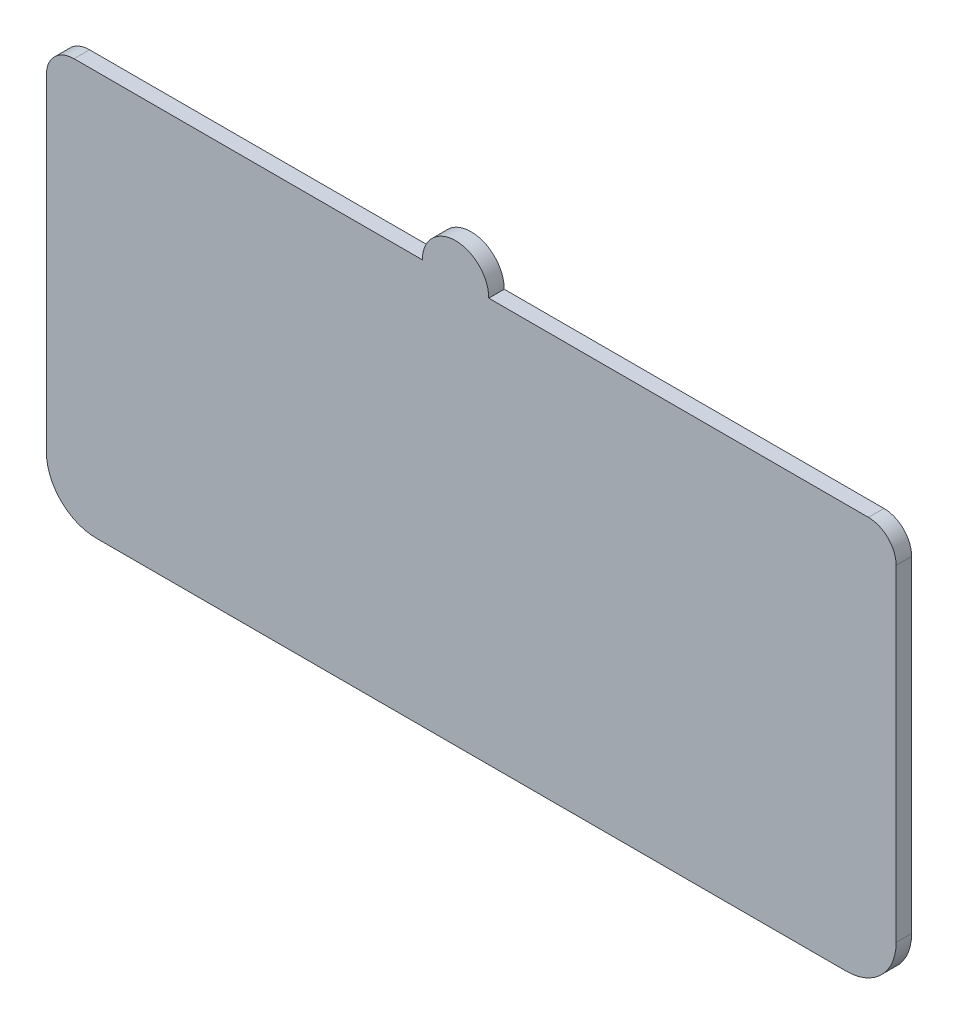
from build123d import *

# Parameters (mm, degrees)
BOSS_EXTRUDE1_DEPTH = 2.8
FILLET1_R           = 9
FILLET2_R           = 5


with BuildPart() as part:
    # Sketch1 → Boss-Extrude1 (new body)
    with BuildSketch(Plane.XY):
        with BuildLine():
            Line((3.163348562, 36.5), (76.75, 36.5))
            Line((76.75, 36.5), (76.75, -36.5))
            Line((76.75, -36.5), (-76.75, -36.5))
            Line((-76.75, -36.5), (-76.75, 36.5))
            Line((-76.75, 36.5), (-8.836651438, 36.5))
            ThreePointArc((-8.836651438, 36.5), (-2.836651438, 42.5), (3.163348562, 36.5))
        make_face()
    extrude(amount=BOSS_EXTRUDE1_DEPTH)

    # Fillet1
    fillet1_edges = [part.edges().sort_by_distance(p)[0] for p in [
        (76.75, -36.5, 1.4),
        (-76.75, -36.5, 1.4),
    ]]
    fillet(fillet1_edges, radius=FILLET1_R)

    # Fillet2
    fillet2_edges = [part.edges().sort_by_distance(p)[0] for p in [
        (-76.75, 36.5, 1.4),
        (76.75, 36.5, 1.4),
    ]]
    fillet(fillet2_edges, radius=FILLET2_R)


solid = part.part
